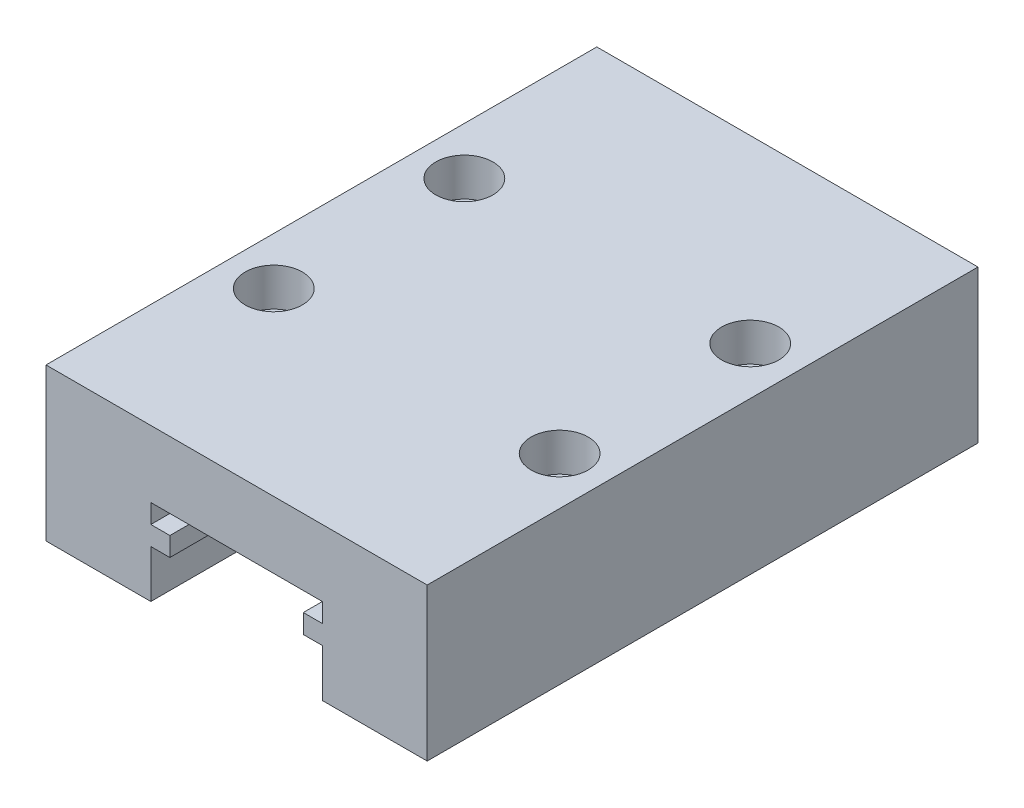
from build123d import *

# Parameters (mm, degrees)
EXTRUDE_1_DEPTH     = 28.9
SKETCH_2_R          = 1.5
CUT_EXTRUDE_1_DEPTH = 2


with BuildPart() as part:
    # 草图1 → 凸台-拉伸1 (new body)
    with BuildSketch(Plane.XY):
        Polygon((10, 8), (-10, 8), (-10, 0), (-4.5, 0), (-4.5, 2.5), (-3.5, 2.5), (-3.5, 3.5), (-4.5, 3.5), (-4.5, 4.5), (4.5, 4.5), (4.5, 3.5), (3.5, 3.5), (3.5, 2.5), (4.5, 2.5), (4.5, 0), (10, 0), align=None)
    extrude(amount=EXTRUDE_1_DEPTH)

    # 草图2 → 切除-拉伸1 (cut)
    with BuildSketch(Plane(origin=(0, 8, 0), x_dir=(1, 0, 0), z_dir=(0, 1, 0))):
        with Locations(Location((-7.5, -9.45, 0), (0, 0, 270))):
            Circle(SKETCH_2_R)
        with Locations(Location((-7.5, -19.45, 0), (0, 0, 270))):
            Circle(SKETCH_2_R)
        with Locations(Location((7.5, -19.45, 0), (0, 0, 90))):
            Circle(SKETCH_2_R)
        with Locations(Location((7.5, -9.45, 0), (0, 0, 90))):
            Circle(SKETCH_2_R)
    extrude(amount=-CUT_EXTRUDE_1_DEPTH, mode=Mode.SUBTRACT)


solid = part.part
